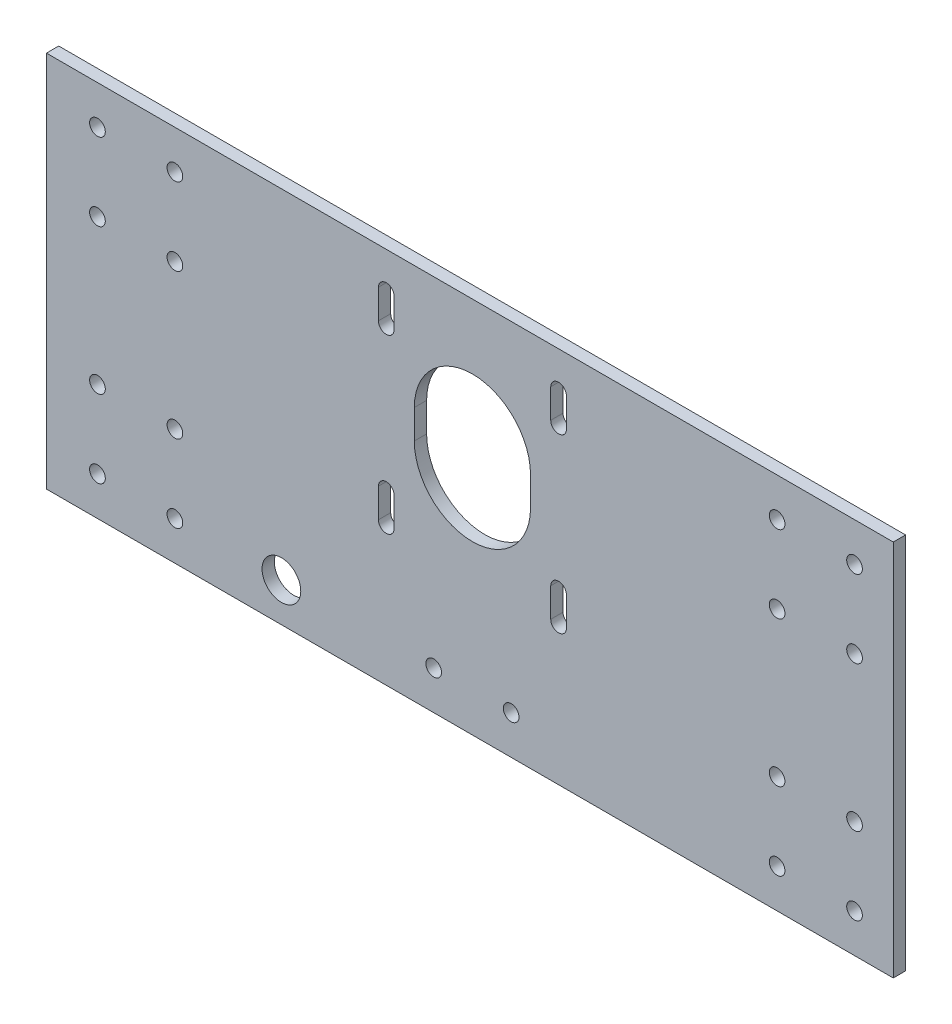
from build123d import *

# Parameters (mm, degrees)
SKETCH1_W           = 437.35
SKETCH1_H           = 195
SKETCH1_R           = 4.05
SKETCH1_R_2         = 10
BOSS_EXTRUDE1_DEPTH = 6.35


with BuildPart() as part:
    # Sketch1 → Boss-Extrude1 (new body)
    with BuildSketch(Plane.XY):
        with Locations((-1.325, -19)):
            Rectangle(SKETCH1_W, SKETCH1_H)
        with Locations((-193.65, 58.5)):
            Circle(SKETCH1_R, mode=Mode.SUBTRACT)
        with Locations((-153.65, 58.5)):
            Circle(SKETCH1_R, mode=Mode.SUBTRACT)
        with Locations((-153.65, 18.5)):
            Circle(SKETCH1_R, mode=Mode.SUBTRACT)
        with Locations((-193.65, 18.5)):
            Circle(SKETCH1_R, mode=Mode.SUBTRACT)
        with Locations((-193.65, -56.5)):
            Circle(SKETCH1_R, mode=Mode.SUBTRACT)
        with Locations((-153.65, -56.5)):
            Circle(SKETCH1_R, mode=Mode.SUBTRACT)
        with Locations((-153.65, -96.5)):
            Circle(SKETCH1_R, mode=Mode.SUBTRACT)
        with Locations((-193.65, -96.5)):
            Circle(SKETCH1_R, mode=Mode.SUBTRACT)
        with Locations((157.35, -56.5)):
            Circle(SKETCH1_R, mode=Mode.SUBTRACT)
        with Locations((197.35, -56.5)):
            Circle(SKETCH1_R, mode=Mode.SUBTRACT)
        with Locations((197.35, -96.5)):
            Circle(SKETCH1_R, mode=Mode.SUBTRACT)
        with Locations((157.35, -96.5)):
            Circle(SKETCH1_R, mode=Mode.SUBTRACT)
        with Locations((157.35, 18.5)):
            Circle(SKETCH1_R, mode=Mode.SUBTRACT)
        with Locations((197.35, 18.5)):
            Circle(SKETCH1_R, mode=Mode.SUBTRACT)
        with Locations((197.35, 58.5)):
            Circle(SKETCH1_R, mode=Mode.SUBTRACT)
        with Locations((157.35, 58.5)):
            Circle(SKETCH1_R, mode=Mode.SUBTRACT)
        with Locations((-98.65, -96.5)):
            Circle(SKETCH1_R_2, mode=Mode.SUBTRACT)
        with Locations((-20, -96.5)):
            Circle(SKETCH1_R, mode=Mode.SUBTRACT)
        with Locations((20, -96.5)):
            Circle(SKETCH1_R, mode=Mode.SUBTRACT)
        with BuildLine():
            Line((-48.55, -44.5), (-48.55, -29.5))
            ThreePointArc((-48.55, -29.5), (-44.5, -25.45), (-40.45, -29.5))
            Line((-40.45, -29.5), (-40.45, -44.5))
            ThreePointArc((-40.45, -44.5), (-44.5, -48.55), (-48.55, -44.5))
        make_face(mode=Mode.SUBTRACT)
        with BuildLine():
            Line((-48.55, 44.5), (-48.55, 59.5))
            ThreePointArc((-48.55, 59.5), (-44.5, 63.55), (-40.45, 59.5))
            Line((-40.45, 59.5), (-40.45, 44.5))
            ThreePointArc((-40.45, 44.5), (-44.5, 40.45), (-48.55, 44.5))
        make_face(mode=Mode.SUBTRACT)
        with BuildLine():
            Line((40.45, 44.5), (40.45, 59.5))
            ThreePointArc((40.45, 59.5), (44.5, 63.55), (48.55, 59.5))
            Line((48.55, 59.5), (48.55, 44.5))
            ThreePointArc((48.55, 44.5), (44.5, 40.45), (40.45, 44.5))
        make_face(mode=Mode.SUBTRACT)
        with BuildLine():
            Line((40.45, -44.5), (40.45, -29.5))
            ThreePointArc((40.45, -29.5), (44.5, -25.45), (48.55, -29.5))
            Line((48.55, -29.5), (48.55, -44.5))
            ThreePointArc((48.55, -44.5), (44.5, -48.55), (40.45, -44.5))
        make_face(mode=Mode.SUBTRACT)
        with BuildLine():
            Line((-30, 0), (-30, 15))
            ThreePointArc((-30, 15), (0, 45), (30, 15))
            Line((30, 15), (30, 0))
            ThreePointArc((30, 0), (0, -30), (-30, 0))
        make_face(mode=Mode.SUBTRACT)
    extrude(amount=BOSS_EXTRUDE1_DEPTH)


solid = part.part
